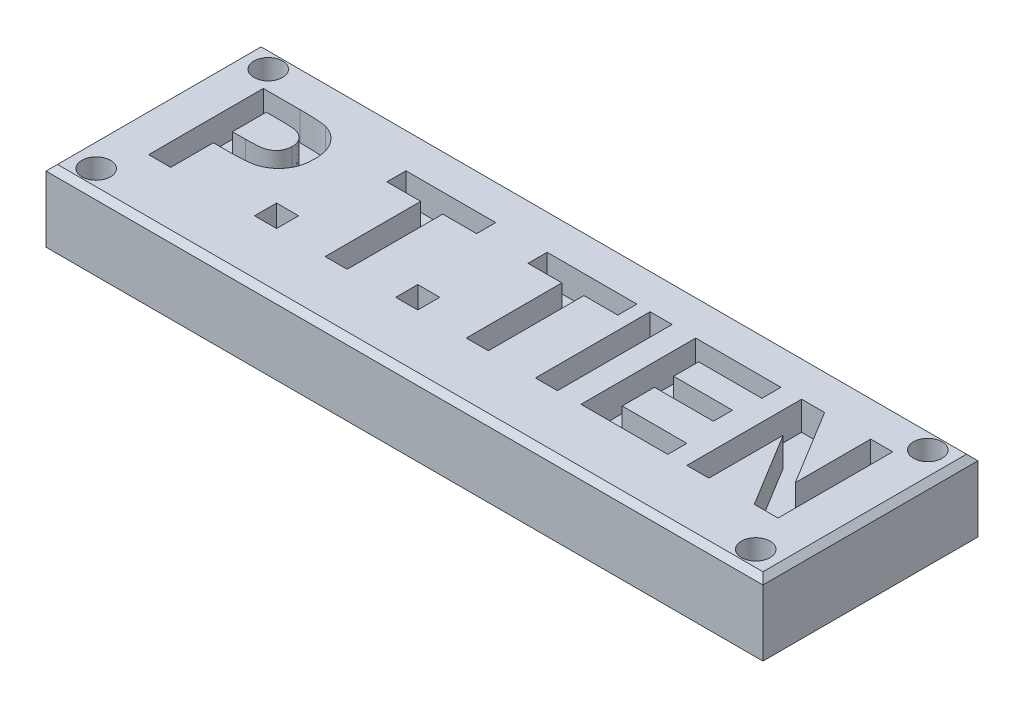
from build123d import *

# Parameters (mm, degrees)
SKETCH1_W           = 500
SKETCH1_H           = 150
BOSS_EXTRUDE1_DEPTH = 50
SKETCH2_W           = 15.384615385
SKETCH2_H           = 15.384615384
SKETCH2_W_2         = 15.384615384
SKETCH2_H_2         = 80
CUT_EXTRUDE1_DEPTH  = 20
SKETCH3_R           = 10
CUT_EXTRUDE2_DEPTH  = 266.753645441
CHAMFER1_SIZE       = 4


with BuildPart() as part:
    # Sketch1 → Boss-Extrude1 (new body)
    with BuildSketch(Plane(origin=(0, 0, 0), x_dir=(1, 0, 0), z_dir=(0, 1, 0))):
        Rectangle(SKETCH1_W, SKETCH1_H)
    extrude(amount=BOSS_EXTRUDE1_DEPTH)

    # Sketch2 → Cut-Extrude1 (cut)
    # profile 1 of 8: a face of its own
    with BuildSketch(Plane(origin=(0, 50, 0), x_dir=(1, 0, 0), z_dir=(0, 1, 0))):
        with BuildLine():
            Line((-220.114547961, -33.307849889), (-220.114547961, 46.692150111))
            Line((-220.114547961, 46.692150111), (-194.521599243, 46.692150111))
            add(Edge.make_bspline(
                [(-194.521599243, 46.692150111), (-193.362373318, 46.690884181), (-191.145215926, 46.68846294), (-187.982575017, 46.621190731), (-185.135090695, 46.525959504), (-182.606989081, 46.407353042), (-180.389374452, 46.23036942), (-178.492194776, 46.025425049), (-176.903503637, 45.804959291), (-175.967970488, 45.576806717), (-175.547240269, 45.474201393)],
                knots=[0, 0, 0, 0, 1.460485487, 2.793352117, 3.985295279, 5.050041172, 5.981765236, 6.787433016, 7.454681457, 8, 8, 8, 8], degree=3))
            add(Edge.make_bspline(
                [(-175.547240269, 45.474201393), (-174.987771388, 45.314675255), (-173.877356736, 44.998053247), (-172.286478808, 44.323065419), (-170.753124402, 43.540790537), (-169.296558471, 42.608460279), (-167.911829693, 41.542626797), (-166.594822019, 40.351982104), (-165.338512035, 39.03115138), (-164.160279176, 37.582743847), (-163.081156481, 36.014063129), (-162.148523341, 34.322789965), (-161.367171772, 32.516275498), (-160.701473221, 30.608095458), (-160.210317655, 28.577791061), (-159.866598053, 26.439469094), (-159.627326323, 24.1921943), (-159.610385144, 22.654342715), (-159.601727448, 21.868432162)],
                knots=[0, 0, 0, 0, 0.907145743, 1.80047177, 2.69161667, 3.591261238, 4.495029544, 5.415863088, 6.359363025, 7.337192411, 8.326890979, 9.326929023, 10.346104993, 11.395420813, 12.477187422, 13.601053412, 14.774031606, 16, 16, 16, 16], degree=3))
            add(Edge.make_bspline(
                [(-159.601727448, 21.868432162), (-159.626419152, 20.674937637), (-159.673952037, 18.377395143), (-160.205760683, 15.083589507), (-161.016899695, 12.074910394), (-162.202437968, 9.380337629), (-163.647855404, 6.989297258), (-165.240012468, 4.833785656), (-167.058021858, 2.978772131), (-169.022220631, 1.394320163), (-171.098019744, 0.097670408), (-173.177576478, -1.007705098), (-175.288951411, -1.857553106), (-176.728482139, -2.227838717), (-177.43826591, -2.410413992)],
                knots=[0, 0, 0, 0, 1.312386234, 2.526415563, 3.661883817, 4.733421185, 5.753802465, 6.732107337, 7.675884281, 8.604170108, 9.50284679, 10.365392406, 11.194030444, 12, 12, 12, 12], degree=3))
            add(Edge.make_bspline(
                [(-177.43826591, -2.410413992), (-177.944874755, -2.5067829), (-179.012745754, -2.70991706), (-180.706325278, -2.912404846), (-182.557499482, -3.136536749), (-184.573882373, -3.282728169), (-186.753034651, -3.419630304), (-189.094110145, -3.484266322), (-191.593763206, -3.562139599), (-193.314257132, -3.563538884), (-194.201086423, -3.564260146)],
                knots=[0, 0, 0, 0, 0.735353946, 1.55003838, 2.431865514, 3.394945452, 4.432993119, 5.54609699, 6.735134699, 8, 8, 8, 8], degree=3))
            Line((-194.201086423, -3.564260146), (-204.729932576, -3.564260146))
            Line((-204.729932576, -3.564260146), (-204.729932576, -33.307849889))
            Line((-204.729932576, -33.307849889), (-220.114547961, -33.307849889))
        make_face()
        with BuildLine():
            Line((-204.729932576, 33.358816777), (-204.729932576, 9.769073188))
            Line((-204.729932576, 9.769073188), (-195.499163346, 9.769073188))
            add(Edge.make_bspline(
                [(-195.499163346, 9.769073188), (-194.703153264, 9.770103954), (-193.180285827, 9.772075938), (-190.995308866, 9.842858626), (-189.017465651, 9.929262023), (-187.242623546, 10.072277323), (-185.681495968, 10.26076807), (-184.32362843, 10.486226744), (-183.167438366, 10.728167456), (-181.917176214, 11.129101986), (-180.580396005, 11.777777497), (-179.152871842, 12.710087135), (-177.89879355, 13.824773264), (-176.855234189, 15.133933521), (-176.021661303, 16.588486417), (-175.42482251, 18.173525213), (-175.039444262, 19.862780272), (-175.004243472, 21.03297104), (-174.986342833, 21.628047547)],
                knots=[0, 0, 0, 0, 1.411705958, 2.700771114, 3.876961699, 4.922619712, 5.858038221, 6.66485904, 7.363650596, 7.950905807, 8.989198271, 9.987739806, 10.967313358, 11.951275539, 12.944273208, 13.927870418, 14.946261014, 16, 16, 16, 16], degree=3))
            add(Edge.make_bspline(
                [(-174.986342833, 21.628047547), (-175.011536019, 22.35284144), (-175.060382286, 23.758121234), (-175.599020255, 25.759474192), (-176.43007709, 27.575726264), (-177.618252422, 29.15036565), (-179.053540257, 30.474507882), (-180.666743883, 31.576241297), (-182.492313993, 32.347242727), (-183.784328311, 32.645977321), (-184.441471038, 32.797919342)],
                knots=[0, 0, 0, 0, 1.085904563, 2.105425768, 3.088705091, 4.068969419, 5.045188284, 6.010769642, 6.988240112, 8, 8, 8, 8], degree=3))
            add(Edge.make_bspline(
                [(-184.441471038, 32.797919342), (-184.724254567, 32.843148261), (-185.351946325, 32.94354244), (-186.39529777, 33.048316251), (-187.629582692, 33.143607927), (-189.056288904, 33.22184524), (-190.669761298, 33.283008702), (-192.475321832, 33.33660298), (-194.468215217, 33.340908569), (-195.862424259, 33.352681985), (-196.588906935, 33.358816777)],
                knots=[0, 0, 0, 0, 0.564603001, 1.253243608, 2.066786758, 3.005752288, 4.070476343, 5.250658742, 6.567396469, 8, 8, 8, 8], degree=3))
            Line((-196.588906935, 33.358816777), (-204.729932576, 33.358816777))
        make_face(mode=Mode.SUBTRACT)
    # profile 2 of 8: a face of its own
    with BuildSketch(Plane(origin=(0, 50, 0), x_dir=(1, 0, 0), z_dir=(0, 1, 0))):
        with Locations((-138.576086422, -25.615542197)):
            Rectangle(SKETCH2_W, SKETCH2_H)
    # profile 3 of 8: a face of its own
    with BuildSketch(Plane(origin=(0, 50, 0), x_dir=(1, 0, 0), z_dir=(0, 1, 0))):
        Polygon((-97.037624884, -33.307849889), (-97.037624884, 33.358816777), (-120.627368474, 33.358816777), (-120.627368474, 46.692150111), (-58.06326591, 46.692150111), (-58.06326591, 33.358816777), (-81.653009499, 33.358816777), (-81.653009499, -33.307849889), align=None)
    # profile 4 of 8: a face of its own
    with BuildSketch(Plane(origin=(0, 50, 0), x_dir=(1, 0, 0), z_dir=(0, 1, 0))):
        with Locations((-40.114547961, -25.615542197)):
            Rectangle(SKETCH2_W_2, SKETCH2_H)
    # profile 5 of 8: a face of its own
    with BuildSketch(Plane(origin=(0, 50, 0), x_dir=(1, 0, 0), z_dir=(0, 1, 0))):
        Polygon((1.423913577, -33.307849889), (1.423913577, 33.358816777), (-22.165830012, 33.358816777), (-22.165830012, 46.692150111), (40.398272552, 46.692150111), (40.398272552, 33.358816777), (16.808528962, 33.358816777), (16.808528962, -33.307849889), align=None)
    # profile 6 of 8: a face of its own
    with BuildSketch(Plane(origin=(0, 50, 0), x_dir=(1, 0, 0), z_dir=(0, 1, 0))):
        with Locations((57.321349475, 6.692150111)):
            Rectangle(SKETCH2_W_2, SKETCH2_H_2)
    # profile 7 of 8: a face of its own
    with BuildSketch(Plane(origin=(0, 50, 0), x_dir=(1, 0, 0), z_dir=(0, 1, 0))):
        Polygon((81.423913577, -33.307849889), (81.423913577, 46.692150111), (140.911093065, 46.692150111), (140.911093065, 33.358816777), (96.808528962, 33.358816777), (96.808528962, 15.922919342), (137.834169988, 15.922919342), (137.834169988, 2.589586008), (96.808528962, 2.589586008), (96.808528962, -19.974516556), (141.93673409, -19.974516556), (141.93673409, -33.307849889), align=None)
    # profile 8 of 8: a face of its own
    with BuildSketch(Plane(origin=(0, 50, 0), x_dir=(1, 0, 0), z_dir=(0, 1, 0))):
        Polygon((155.270067424, -33.307849889), (155.270067424, 46.692150111), (171.343785372, 46.692150111), (203.475195629, -5.904003735), (203.475195629, 46.692150111), (218.859811013, 46.692150111), (218.859811013, -33.307849889), (202.289298193, -33.307849889), (170.654682808, 18.454970624), (170.654682808, -33.307849889), align=None)
    extrude(amount=-CUT_EXTRUDE1_DEPTH, mode=Mode.SUBTRACT)

    # Sketch3 → Cut-Extrude2 (cut, through all)
    with BuildSketch(Plane(origin=(0, 50, 0), x_dir=(1, 0, 0), z_dir=(0, 1, 0))):
        with Locations(Location((-230, 60, 0), (0, 0, 270))):
            Circle(SKETCH3_R)
        with Locations(Location((-230, -60, 0), (0, 0, 270))):
            Circle(SKETCH3_R)
        with Locations(Location((230, -60, 0), (0, 0, 270))):
            Circle(SKETCH3_R)
        with Locations(Location((230, 60, 0), (0, 0, 270))):
            Circle(SKETCH3_R)
    extrude(amount=-CUT_EXTRUDE2_DEPTH, mode=Mode.SUBTRACT)

    # Chamfer1
    chamfer1_edges = [part.edges().sort_by_distance(p)[0] for p in [
        (-250, 50, 0),
        (0, 50, 75),
        (250, 50, 0),
        (0, 50, -75),
    ]]
    chamfer(chamfer1_edges, length=CHAMFER1_SIZE)


solid = part.part
